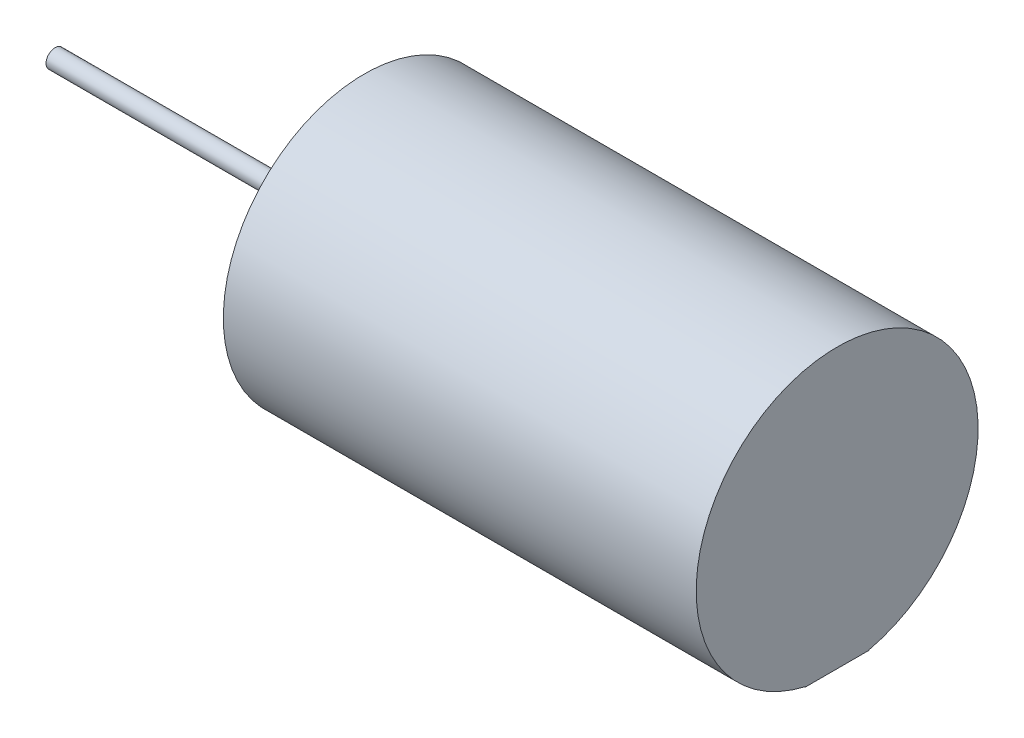
from build123d import *

# Parameters (mm, degrees)
SKETCH1_W           = 52
SKETCH1_H           = 40
BOSS_EXTRUDE1_DEPTH = 3
SKETCH2_W           = 35
SKETCH2_H           = 7
BOSS_EXTRUDE2_DEPTH = 40
CUT_EXTRUDE1_DEPTH  = 56.472966389
SKETCH4_W           = 52
SKETCH4_H           = 40
BOSS_EXTRUDE3_DEPTH = 31
CUT_EXTRUDE10_DEPTH = 93.628289415
CUT_EXTRUDE11_DEPTH = 93.628289415
SKETCH8_R           = 5
BOSS_EXTRUDE4_DEPTH = 3
SKETCH9_R           = 1
BOSS_EXTRUDE5_DEPTH = 31
SKETCH10_W          = 43.211860489
SKETCH10_H          = 44.174227803
CUT_EXTRUDE12_DEPTH = 70


with BuildPart() as part:
    # Sketch1 → Boss-Extrude1 (new body)
    with BuildSketch(Plane(origin=(0, 0, 0), x_dir=(1, 0, 0), z_dir=(0, 1, 0))):
        Rectangle(SKETCH1_W, SKETCH1_H)
    extrude(amount=BOSS_EXTRUDE1_DEPTH)

    # Sketch2 → Boss-Extrude2 (add)
    with BuildSketch(Plane(origin=(0, 3, 0), x_dir=(1, 0, 0), z_dir=(0, 1, 0))):
        with Locations((1.5, 0)):
            Rectangle(SKETCH2_W, SKETCH2_H)
    extrude(amount=BOSS_EXTRUDE2_DEPTH)

    # Sketch3 → Cut-Extrude1 (cut, through all)
    with BuildSketch(Plane(origin=(0, 0, -3.5), x_dir=(-1, 0, 0), z_dir=(0, 0, -1))):
        Polygon((1, 43), (16, 3), (16, 43), align=None)
    extrude(amount=-CUT_EXTRUDE1_DEPTH, mode=Mode.SUBTRACT)

    # Sketch4 → Boss-Extrude3 (add)
    with BuildSketch(Plane(origin=(0, 43, 0), x_dir=(1, 0, 0), z_dir=(0, 1, 0))):
        Rectangle(SKETCH4_W, SKETCH4_H)
    extrude(amount=BOSS_EXTRUDE3_DEPTH)

    # Sketch5 → Cut-Extrude10 (cut, through all)
    with BuildSketch(Plane.ZY.offset(26)):
        with BuildLine():
            Line((-20, 43), (-20, 74))
            Line((-20, 74), (0, 74))
            ThreePointArc((0, 74), (-15.399591999, 60.261410302), (-3.5, 43.400331129))
            Line((-3.5, 43.400331129), (-3.5, 43))
            Line((-3.5, 43), (-20, 43))
        make_face()
    extrude(amount=-CUT_EXTRUDE10_DEPTH, mode=Mode.SUBTRACT)

    # Sketch7 → Cut-Extrude11 (cut, through all)
    with BuildSketch(Plane.ZY.offset(26)):
        with BuildLine():
            Line((0, 74), (20, 74))
            Line((20, 74), (20, 43))
            Line((20, 43), (3.5, 43))
            Line((3.5, 43), (3.5, 43.400331129))
            ThreePointArc((3.5, 43.400331129), (15.399591999, 60.261410302), (0, 74))
        make_face()
    extrude(amount=-CUT_EXTRUDE11_DEPTH, mode=Mode.SUBTRACT)

    # Sketch8 → Boss-Extrude4 (add)
    with BuildSketch(Plane.ZY.offset(26)):
        with Locations(Location((0, 58.5, 0), (0, 0, 180))):
            Circle(SKETCH8_R)
    extrude(amount=BOSS_EXTRUDE4_DEPTH)

    # Sketch9 → Boss-Extrude5 (add)
    with BuildSketch(Plane.ZY.offset(29)):
        with Locations((0, 58.5)):
            Circle(SKETCH9_R)
    extrude(amount=BOSS_EXTRUDE5_DEPTH)

    # Sketch10 → Cut-Extrude12 (cut)
    with BuildSketch(Plane.ZY.offset(-30)):
        with Locations((-0.422313508, 21.268278388)):
            Rectangle(SKETCH10_W, SKETCH10_H)
    extrude(amount=CUT_EXTRUDE12_DEPTH, mode=Mode.SUBTRACT)


solid = part.part
